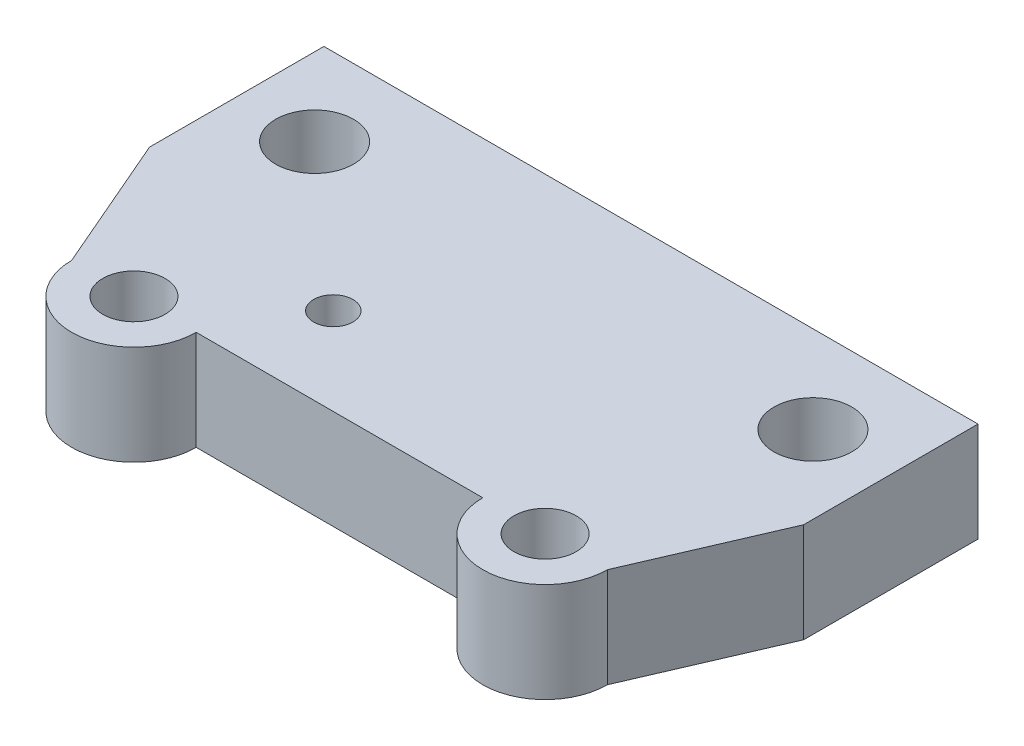
from build123d import *

# Parameters (mm, degrees)
SKETCH1_R           = 3.175
SKETCH1_R_2         = 3.96875
SKETCH1_R_3         = 2
BOSS_EXTRUDE1_DEPTH = 10.16


with BuildPart() as part:
    # Sketch1 → Boss-Extrude1 (new body)
    with BuildSketch(Plane(origin=(0, 0, 0), x_dir=(1, 0, 0), z_dir=(0, 1, 0))):
        with BuildLine():
            Line((54.2925, 31.75), (-12.3825, 31.75))
            Line((-12.3825, 31.75), (-12.3825, 13.97))
            Line((-12.3825, 13.97), (-6.35, 0))
            ThreePointArc((-6.35, 0), (0, -6.35), (6.35, 0))
            Line((6.35, 0), (35.56, 0))
            ThreePointArc((35.56, 0), (41.91, -6.35), (48.26, 0))
            Line((48.26, 0), (54.2925, 13.97))
            Line((54.2925, 13.97), (54.2925, 31.75))
        make_face()
        with Locations(Location((0, 0, 0), (0, 0, 270))):
            Circle(SKETCH1_R, mode=Mode.SUBTRACT)
        with Locations(Location((41.91, 0, 0), (0, 0, 270))):
            Circle(SKETCH1_R, mode=Mode.SUBTRACT)
        with Locations(Location((46.355, 22.86, 0), (0, 0, 270))):
            Circle(SKETCH1_R_2, mode=Mode.SUBTRACT)
        with Locations(Location((-4.445, 22.86, 0), (0, 0, 270))):
            Circle(SKETCH1_R_2, mode=Mode.SUBTRACT)
        with Locations(Location((11.43, 8.89, 0), (0, 0, 270))):
            Circle(SKETCH1_R_3, mode=Mode.SUBTRACT)
    extrude(amount=-BOSS_EXTRUDE1_DEPTH)


solid = part.part
